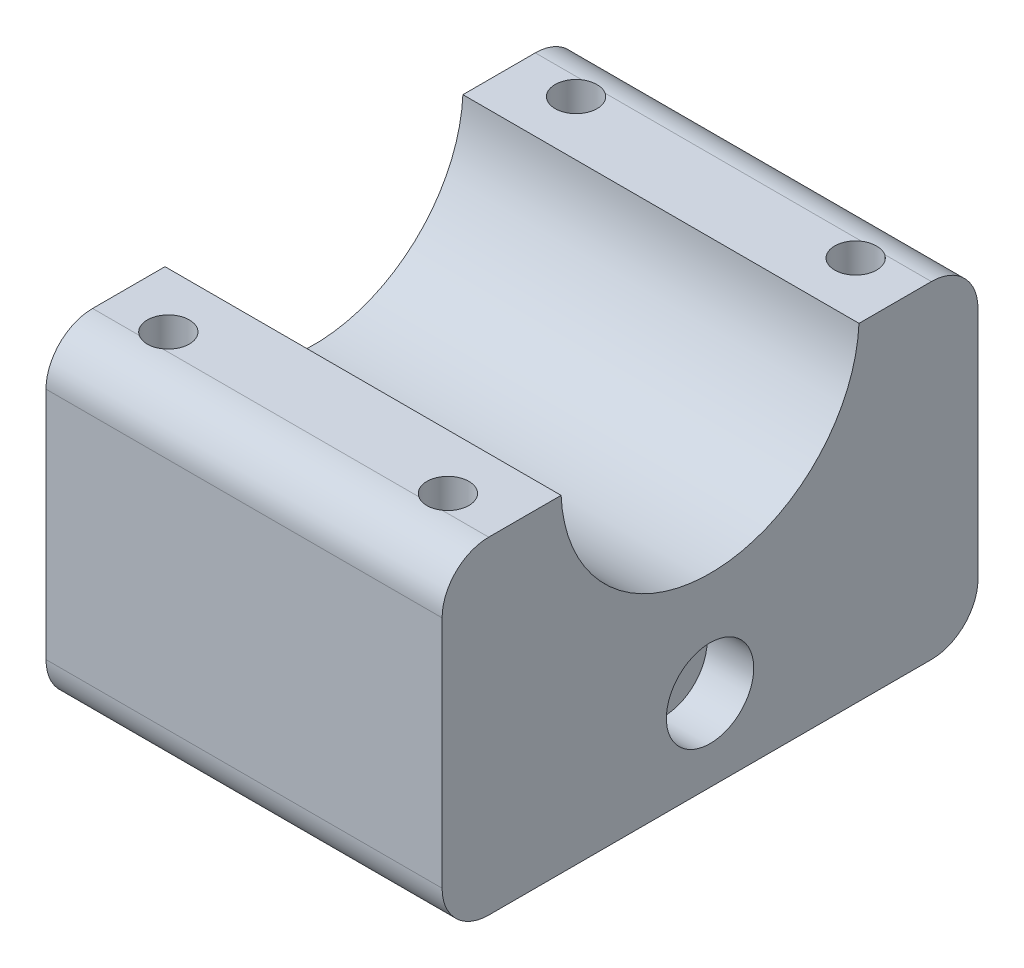
from build123d import *

# Parameters (mm, degrees)
BOSS_EXTRUDE1_DEPTH     = 17
CUT_EXTRUDE1_DEPTH      = 41.517773878
CUT_EXTRUDE1_DEPTH_BACK = 41.517773878
SKETCH2_R               = 12.8
SKETCH3_R               = 1.8
CUT_EXTRUDE2_DEPTH      = 28.5
SKETCH4_R               = 3.25
CUT_EXTRUDE3_DEPTH      = 15.3
SKETCH5_R               = 12.85
CUT_EXTRUDE4_DEPTH      = 14
CUT_EXTRUDE5_DEPTH      = 41.517774047
CUT_EXTRUDE5_DEPTH_BACK = 41.517774047
SKETCH6_R               = 1.8
SKETCH7_R               = 3.75
CUT_EXTRUDE6_DEPTH      = 4
CUT_EXTRUDE7_DEPTH      = 4.3


with BuildPart() as part:
    # Sketch1 → Boss-Extrude1 (new, symmetric)
    with BuildSketch(Plane(origin=(0, 0, 0), x_dir=(0, 0, -1), z_dir=(1, 0, 0))):
        with BuildLine():
            Line((-19, -28.7), (19, -28.7))
            ThreePointArc((19, -28.7), (21.828427125, -27.528427125), (23, -24.7))
            Line((23, -24.7), (23, -4.6))
            ThreePointArc((23, -4.6), (21.828427125, -1.771572875), (19, -0.6))
            Line((19, -0.6), (-19, -0.6))
            ThreePointArc((-19, -0.6), (-21.828427125, -1.771572875), (-23, -4.6))
            Line((-23, -4.6), (-23, -24.7))
            ThreePointArc((-23, -24.7), (-21.828427125, -27.528427125), (-19, -28.7))
        make_face()
    extrude(amount=BOSS_EXTRUDE1_DEPTH, both=True)

    # Sketch2 → Cut-Extrude1 (cut, two sides: drawn at the far end of the back side and taken through both)
    with BuildSketch(Plane(origin=(0, 0, 0), x_dir=(0, 0, -1), z_dir=(1, 0, 0)).offset(-CUT_EXTRUDE1_DEPTH_BACK)):
        Circle(SKETCH2_R)
    extrude(amount=CUT_EXTRUDE1_DEPTH + CUT_EXTRUDE1_DEPTH_BACK, mode=Mode.SUBTRACT)

    # Sketch3 → Cut-Extrude2 (cut)
    with BuildSketch(Plane(origin=(0, -28.7, 0), x_dir=(1, 0, 0), z_dir=(0, 1, 0))):
        with Locations(Location((12, -17.5, 0), (0, 0, 236.442690238))):
            Circle(SKETCH3_R)
        with Locations(Location((12, 17.5, 0), (0, 0, 56.442690238))):
            Circle(SKETCH3_R)
        with Locations(Location((-12, -17.5, 0), (0, 0, 236.442690238))):
            Circle(SKETCH3_R)
        with Locations(Location((-12, 17.5, 0), (0, 0, 56.442690238))):
            Circle(SKETCH3_R)
    extrude(amount=CUT_EXTRUDE2_DEPTH, mode=Mode.SUBTRACT)

    # Sketch4 → Cut-Extrude3 (cut)
    with BuildSketch(Plane(origin=(0, -28.7, 0), x_dir=(1, 0, 0), z_dir=(0, 1, 0))):
        with Locations(Location((12, -17.5, 0), (0, 0, 207.48642625))):
            Circle(SKETCH4_R)
        with Locations(Location((12, 17.5, 0), (0, 0, 27.48642625))):
            Circle(SKETCH4_R)
        with Locations(Location((-12, -17.5, 0), (0, 0, 207.48642625))):
            Circle(SKETCH4_R)
        with Locations(Location((-12, 17.5, 0), (0, 0, 27.48642625))):
            Circle(SKETCH4_R)
    extrude(amount=CUT_EXTRUDE3_DEPTH, mode=Mode.SUBTRACT)

    # Sketch5 → Cut-Extrude4 (cut)
    with BuildSketch(Plane(origin=(0, -28.7, 0), x_dir=(1, 0, 0), z_dir=(0, 1, 0))):
        with Locations(Location((0, 0, 0), (0, 0, 270))):
            Circle(SKETCH5_R)
    extrude(amount=CUT_EXTRUDE4_DEPTH, mode=Mode.SUBTRACT)

    # Sketch6 → Cut-Extrude5 (cut, two sides: drawn at the far end of the back side and taken through both)
    with BuildSketch(Plane(origin=(0, 0, 0), x_dir=(0, 0, -1), z_dir=(1, 0, 0)).offset(-CUT_EXTRUDE5_DEPTH_BACK)):
        with Locations((0, -21.7)):
            Circle(SKETCH6_R)
    extrude(amount=CUT_EXTRUDE5_DEPTH + CUT_EXTRUDE5_DEPTH_BACK, mode=Mode.SUBTRACT)

    # Sketch7 → Cut-Extrude6 (cut)
    with BuildSketch(Plane(origin=(17, 0, 0), x_dir=(0, 0, -1), z_dir=(1, 0, 0))):
        with Locations((0, -21.7)):
            Circle(SKETCH7_R)
    extrude(amount=-CUT_EXTRUDE6_DEPTH, mode=Mode.SUBTRACT)

    # Sketch8 → Cut-Extrude7 (cut)
    with BuildSketch(Plane(origin=(-17, 0, 0), x_dir=(0, 0, -1), z_dir=(1, 0, 0))):
        Polygon((-2.85, -20.054551733), (0, -18.409103466), (2.85, -20.054551733), (2.85, -23.345448267), (0, -24.990896534), (-2.85, -23.345448267), align=None)
    extrude(amount=CUT_EXTRUDE7_DEPTH, mode=Mode.SUBTRACT)


solid = part.part
